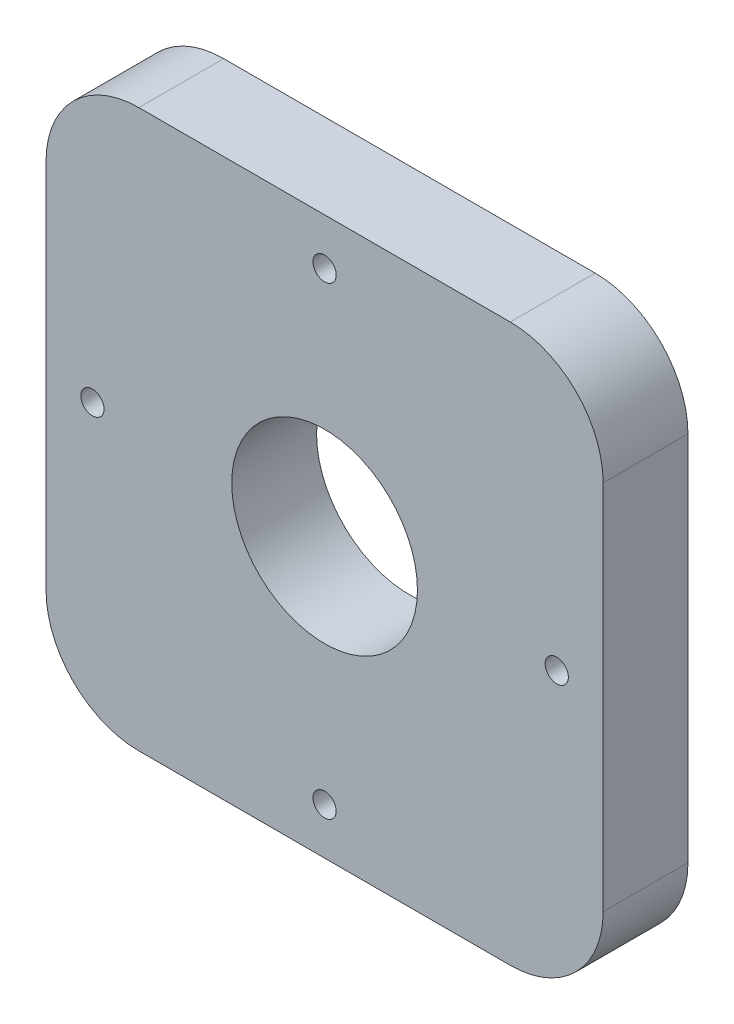
from build123d import *

# Parameters (mm, degrees)
SKETCH1_W           = 38.1
SKETCH1_H           = 38.1
BOSS_EXTRUDE1_DEPTH = 5.8
SKETCH2_R           = 0.79375
CUT_EXTRUDE1_DEPTH  = 28.558029683
SKETCH3_R           = 6.35
CUT_EXTRUDE2_DEPTH  = 12.7
FILLET1_R           = 6.35


with BuildPart() as part:
    # Sketch1 → Boss-Extrude1 (new body)
    with BuildSketch(Plane.XY):
        Rectangle(SKETCH1_W, SKETCH1_H)
    extrude(amount=BOSS_EXTRUDE1_DEPTH)

    # Sketch2 → Cut-Extrude1 (cut, through all)
    with BuildSketch(Plane.XY.offset(5.8)):
        with Locations((0, 15.875)):
            Circle(SKETCH2_R)
        with Locations((15.875, 0)):
            Circle(SKETCH2_R)
        with Locations((0, -15.875)):
            Circle(SKETCH2_R)
        with Locations((-15.875, 0)):
            Circle(SKETCH2_R)
    extrude(amount=-CUT_EXTRUDE1_DEPTH, mode=Mode.SUBTRACT)

    # Sketch3 → Cut-Extrude2 (cut)
    with BuildSketch(Plane.XY.offset(5.8)):
        Circle(SKETCH3_R)
    extrude(amount=-CUT_EXTRUDE2_DEPTH, mode=Mode.SUBTRACT)

    # Fillet1
    fillet1_edges = [part.edges().sort_by_distance(p)[0] for p in [
        (19.05, -19.05, 2.9),
        (-19.05, -19.05, 2.9),
        (-19.05, 19.05, 2.9),
        (19.05, 19.05, 2.9),
    ]]
    fillet(fillet1_edges, radius=FILLET1_R)


solid = part.part
